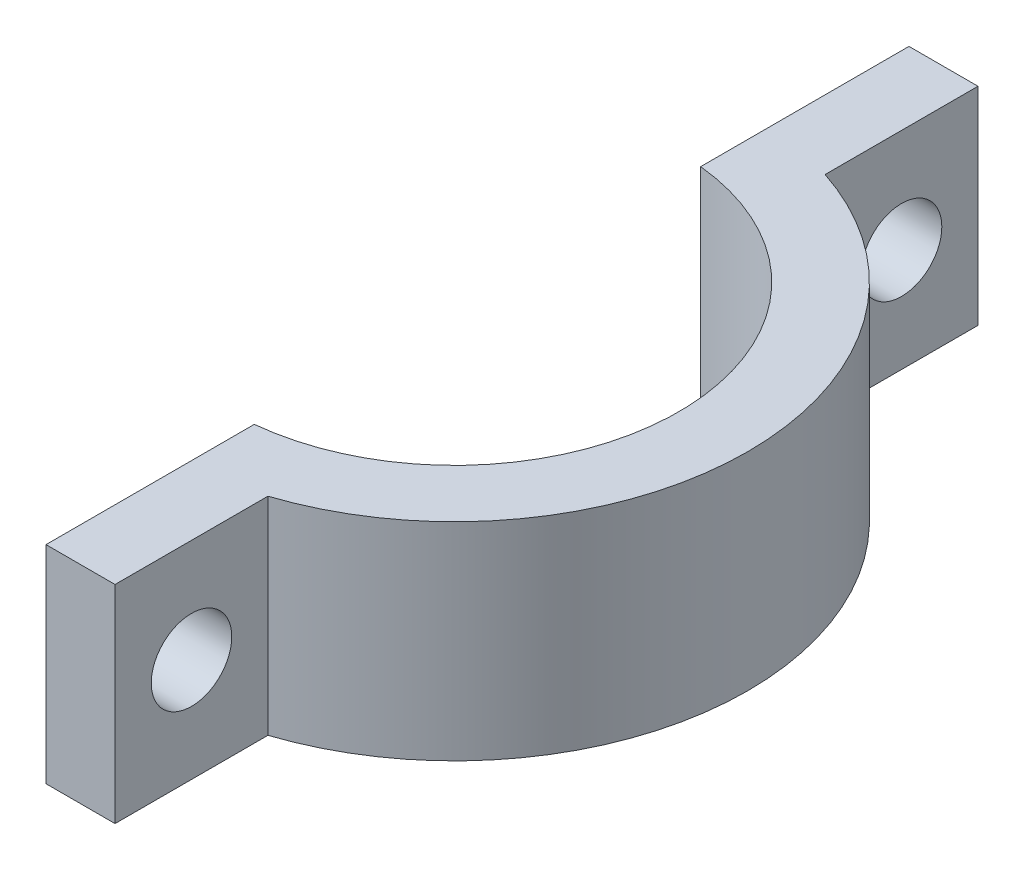
from build123d import *

# Parameters (mm, degrees)
BOSS_EXTRUDE1_DEPTH = 9
SKETCH7_R           = 1.75
CUT_EXTRUDE1_DEPTH  = 10


with BuildPart() as part:
    # Sketch1 → Boss-Extrude1 (new body)
    with BuildSketch(Plane(origin=(0, 0, 0), x_dir=(1, 0, 0), z_dir=(0, 1, 0))):
        with BuildLine():
            Line((4, -18.75), (4, -12.106300013))
            ThreePointArc((4, -12.106300013), (12.75, 0), (4, 12.106300013))
            Line((4, 12.106300013), (4, 18.75))
            Line((4, 18.75), (1, 18.75))
            Line((1, 18.75), (1, 9.698582371))
            ThreePointArc((1, 9.698582371), (9.75, 0), (1, -9.698582371))
            Line((1, -9.698582371), (1, -18.75))
            Line((1, -18.75), (4, -18.75))
        make_face()
    extrude(amount=BOSS_EXTRUDE1_DEPTH)

    # Sketch7 → Cut-Extrude1 (cut)
    with BuildSketch(Plane(origin=(4, 0, 0), x_dir=(0, 0, -1), z_dir=(1, 0, 0))):
        with Locations((-15.428150006, 4.5)):
            Circle(SKETCH7_R)
        with Locations((15.428150006, 4.5)):
            Circle(SKETCH7_R)
    extrude(amount=-CUT_EXTRUDE1_DEPTH, mode=Mode.SUBTRACT)


solid = part.part
